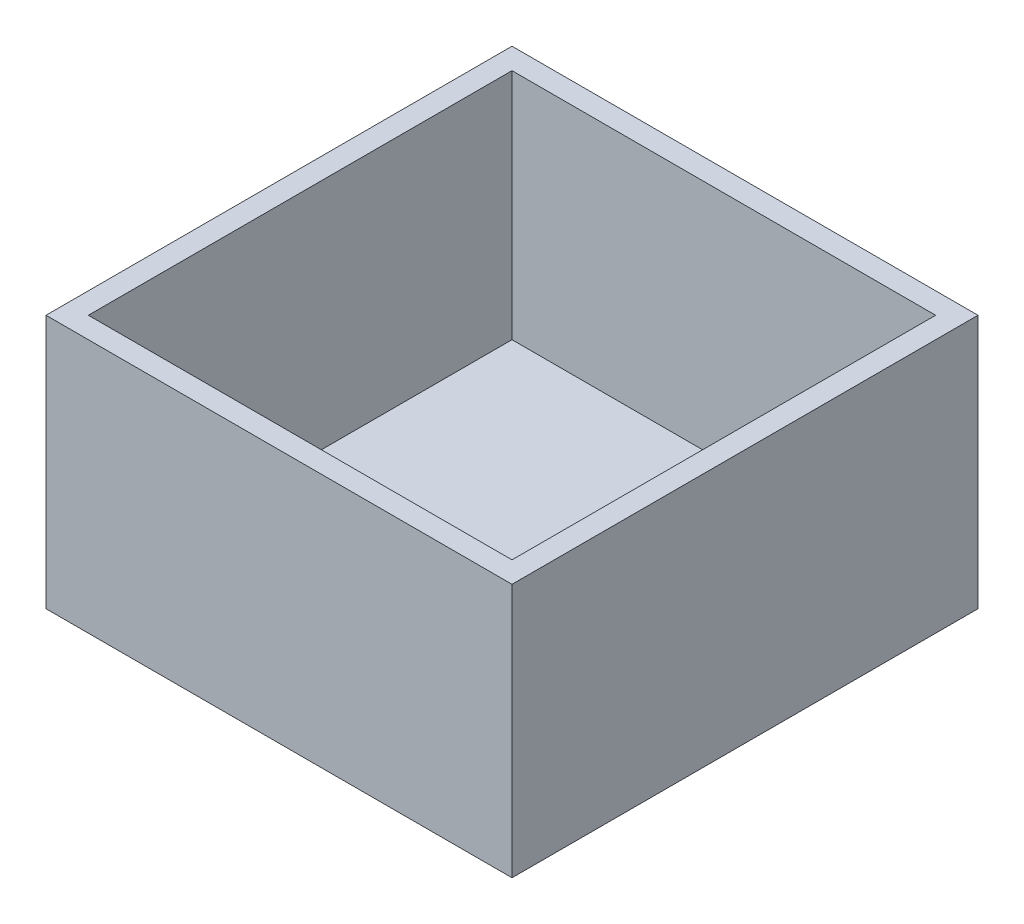
from build123d import *

# Parameters (mm, degrees)
SKETCH1_W           = 139.7
SKETCH1_H           = 139.7
BOSS_EXTRUDE1_DEPTH = 76.2
SHELL2_T            = -6.35


with BuildPart() as part:
    # Sketch1 → Boss-Extrude1 (new body)
    with BuildSketch(Plane(origin=(0, 0, 0), x_dir=(1, 0, 0), z_dir=(0, 1, 0))):
        Rectangle(SKETCH1_W, SKETCH1_H)
    extrude(amount=BOSS_EXTRUDE1_DEPTH)

    # Shell2
    shell2_openings = [part.faces().sort_by_distance(p)[0] for p in [
        (0, 76.2, 0),
    ]]
    offset(amount=SHELL2_T, openings=shell2_openings, kind=Kind.INTERSECTION)


solid = part.part
